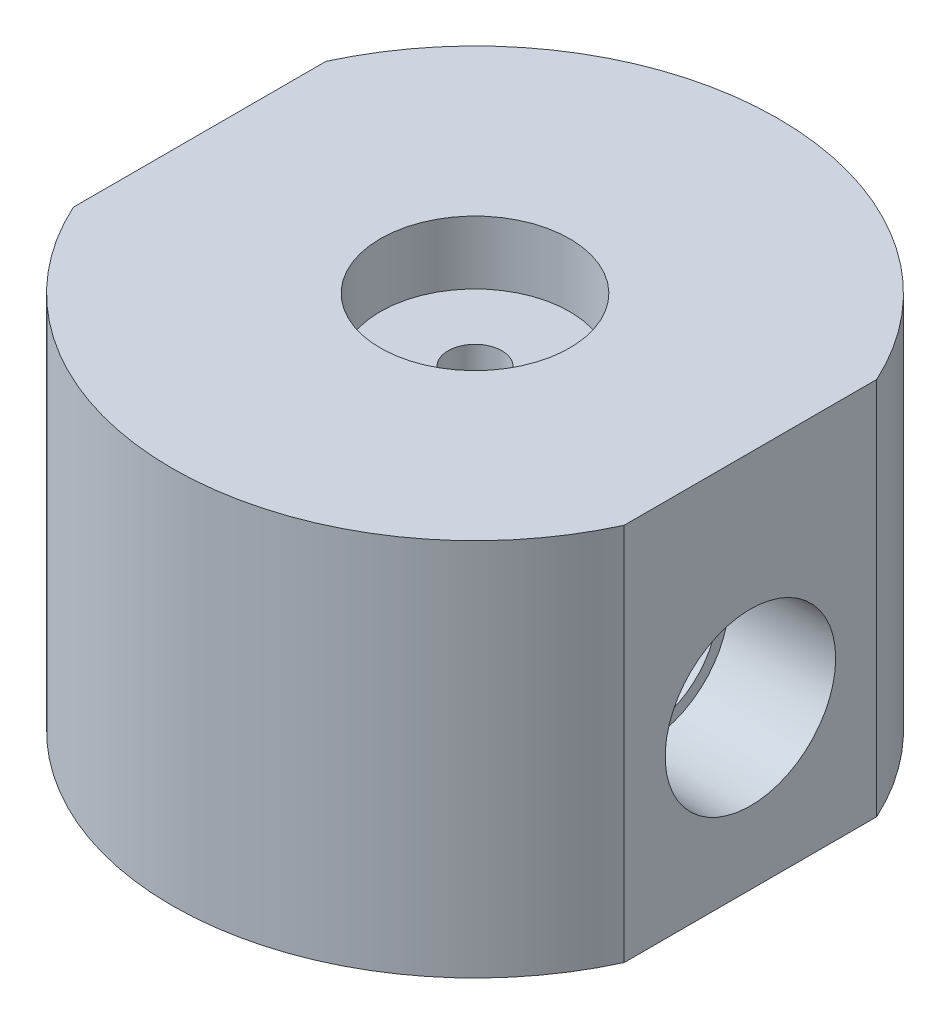
from build123d import *

# Parameters (mm, degrees)
F_1_4_28_TAPPED_HOLE1_D = 5.4102
SKETCH4_W               = 25.4
SKETCH4_H               = 25.4
FLATS_DEPTH             = 58.529738397
FILLET1_R               = 1.5875
SKETCH7_R               = 9.525
CUT_EXTRUDE1_DEPTH      = 6.35


with BuildPart() as part:
    # Sketch1 → Revolve1 (revolve)
    with BuildSketch(Plane.XY, mode=Mode.PRIVATE) as revolve1_sk:
        with BuildLine():
            Line((0, 38.1), (-30.48, 38.1))
            Line((-30.48, 38.1), (-30.48, 0))
            Line((-30.48, 0), (-12.7, 0))
            Line((-12.7, 0), (-12.7, 25.4))
            Line((-12.7, 25.4), (-9.525, 25.4))
            ThreePointArc((-9.525, 25.4), (-6.157403955, 24.005096045), (-4.7625, 20.6375))
            Line((-4.7625, 20.6375), (0, 20.6375))
            Line((0, 20.6375), (0, 38.1))
        make_face()
    revolve(revolve1_sk.sketch.rotate(Axis((0, 0, 0), (0, 1, 0)), 180), axis=Axis((0, 0, 0), (0, 1, 0)))

    # 1/4-28 Tapped Hole1 (through all)
    with Locations(Plane(origin=(0, 38.1, 0), x_dir=(1, 0, 0), z_dir=(0, 1, 0))):
        with Locations((0, 0)):
            Hole(F_1_4_28_TAPPED_HOLE1_D / 2)

    # Sketch4 → flats (cut, through all)
    with BuildSketch(Plane(origin=(0, 0, 0), x_dir=(1, 0, 0), z_dir=(0, 1, 0))):
        with Locations((-40.408128771, 0)):
            Rectangle(SKETCH4_W, SKETCH4_H)
        with Locations((40.408128771, 0)):
            Rectangle(SKETCH4_W, SKETCH4_H)
    extrude(amount=FLATS_DEPTH, mode=Mode.SUBTRACT)

    # Sketch6 → 3/8 NPT Tapped Hole1 (revolve, cut)
    with BuildSketch(Plane(origin=(27.708128771, 15.875, 0), x_dir=(0, 0, -1), z_dir=(0, 1, 0))):
        Polygon((0, 0), (0, 21.814582582), (7.1374, 17.526), (7.1374, 10.414), (8.263205494, 10.414), (8.5750146, 0), align=None)
    f_3_8_npt_tapped_hole1 = revolve(axis=Axis((34.058128771, 15.875, 0), (-1, 0, 0)), mode=Mode.SUBTRACT)

    # Mirror1: 3/8 NPT Tapped Hole1 across plane
    add(f_3_8_npt_tapped_hole1.mirror(Plane(origin=(0, 0, 0), x_dir=(0, 0, 1), z_dir=(1, 0, 0))), mode=Mode.SUBTRACT)

    # Fillet1
    fillet1_edges = [part.edges().sort_by_distance(p)[0] for p in [
        (-12.7, 25.4, 0),
    ]]
    fillet(fillet1_edges, radius=FILLET1_R)

    # Sketch7 → Cut-Extrude1 (cut)
    with BuildSketch(Plane(origin=(0, 38.1, 0), x_dir=(1, 0, 0), z_dir=(0, 1, 0))):
        with Locations(Location((0, 0, 0), (0, 0, 180))):
            Circle(SKETCH7_R)
    extrude(amount=-CUT_EXTRUDE1_DEPTH, mode=Mode.SUBTRACT)


solid = part.part
